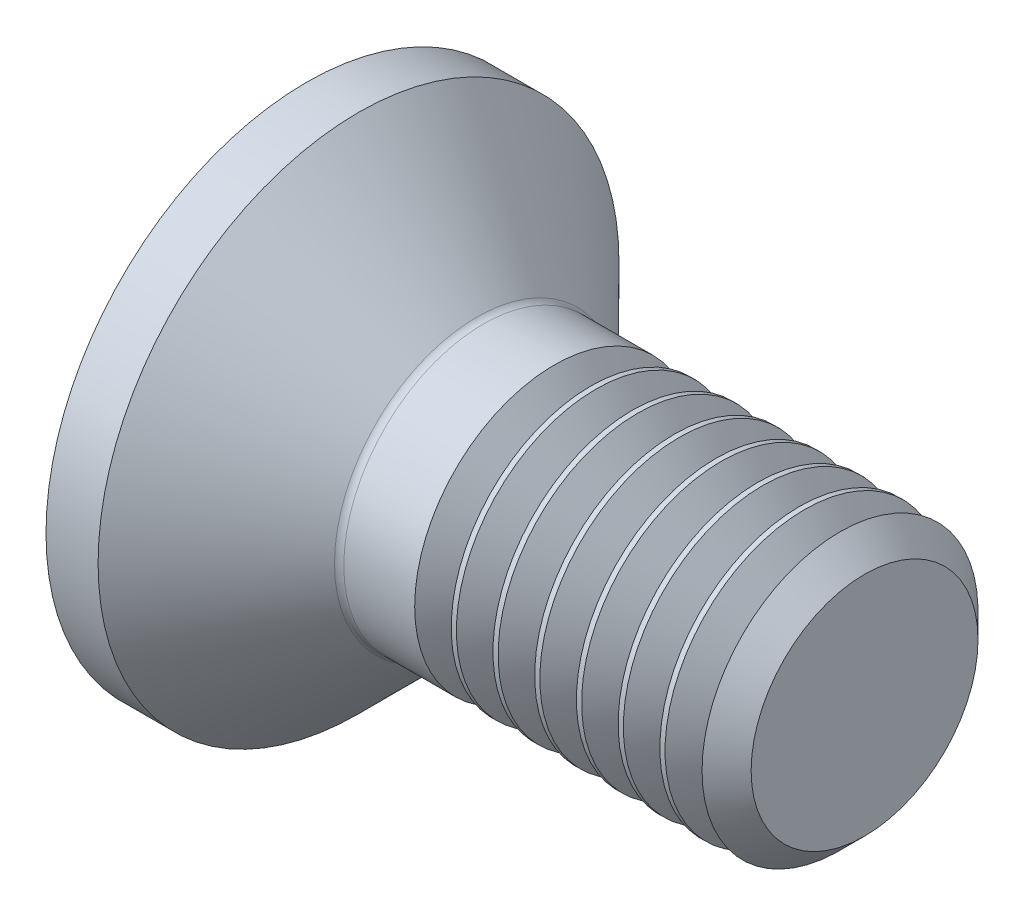
from build123d import *

# Parameters (mm, degrees)
FILLET1_R       = 0.1
HEX_2_DEPTH     = 1.1
THDSCHPAT_COUNT = 7
THDSCHPAT_PITCH = 0.448571429


with BuildPart() as part:
    # BodySke → BaseBody (revolve)
    with BuildSketch(Plane.XY, mode=Mode.PRIVATE) as basebody_sk:
        Polygon((0, 0), (0, 2.8), (0.56, 2.8), (1.86, 1.5), (5.7195, 1.5), (6, 1.2195), (6, 0), align=None)
    revolve(basebody_sk.sketch.rotate(Axis((0, 0, 0), (1, 0, 0)), 90), axis=Axis((0, 0, 0), (1, 0, 0)))

    # Fillet1
    fillet1_edges = [part.edges().sort_by_distance(p)[0] for p in [
        (1.86, 0, -1.5),
    ]]
    fillet(fillet1_edges, radius=FILLET1_R)

    # Sketch2 → PreBroach (revolve, cut)
    with BuildSketch(Plane.XY, mode=Mode.PRIVATE) as prebroach_sk:
        Polygon((0, 1), (1.1, 1), (1.677350269, 0), (0, 0), align=None)
    revolve(prebroach_sk.sketch.rotate(Axis((0, 0, 0), (1, 0, 0)), 90), axis=Axis((0, 0, 0), (1, 0, 0)), mode=Mode.SUBTRACT)

    # Sketch3 → Hex 2 (cut)
    with BuildSketch(Plane.ZY):
        Polygon((-1, -0.577350269), (-1, 0.577350269), (0, 1.154700538), (1, 0.577350269), (1, -0.577350269), (0, -1.154700538), align=None)
    extrude(amount=-HEX_2_DEPTH, mode=Mode.SUBTRACT)

    # ThdSchSke → ThreadSchematic (revolve, cut)
    with BuildSketch(Plane.XY, mode=Mode.PRIVATE) as threadschematic_sk:
        Polygon((2.860001, -1.2195), (2.663592786, -1.5), (2.663592786, -1.875), (3.056409214, -1.875), (3.056409214, -1.5), align=None)
    threadschematic = revolve(threadschematic_sk.sketch.rotate(Axis((-3.175, 0, 0), (1, 0, 0)), 270), axis=Axis((-3.175, 0, 0), (1, 0, 0)), mode=Mode.SUBTRACT)

    # ThdSchPat: ThreadSchematic ×7
    with Locations(*[(i * THDSCHPAT_PITCH, 0, 0) for i in range(1, THDSCHPAT_COUNT)]):
        add(threadschematic, mode=Mode.SUBTRACT)


solid = part.part
